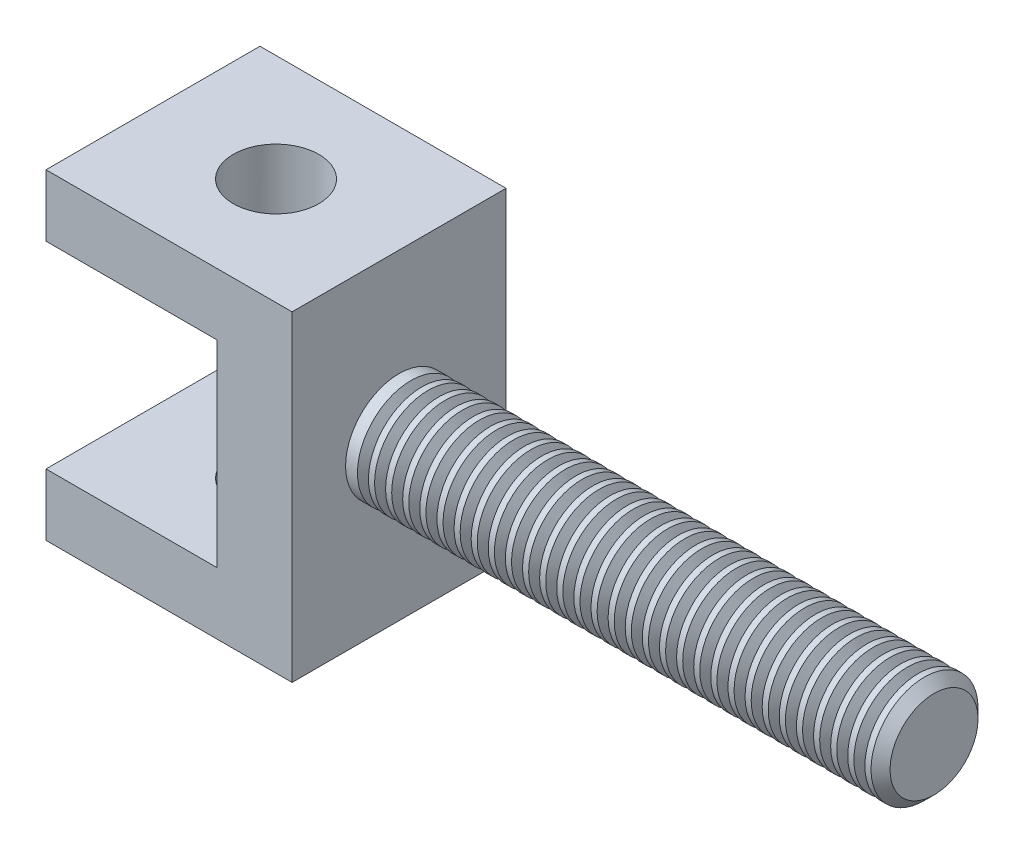
from build123d import *

# Parameters (mm, degrees)
BASEHEAD_DEPTH      = 3.5
THDSCHPAT_COUNT     = 30
THDSCHPAT_PITCH     = 0.8
BOSS_EXTRUDE1_DEPTH = 5
SKETCH3_R           = 2
CUT_EXTRUDE1_DEPTH  = 17


with BuildPart() as part:
    # BaseHeadSke → BaseHead (new body)
    with BuildSketch(Plane(origin=(0, 0, 0), x_dir=(0, 0, -1), z_dir=(1, 0, 0))):
        Polygon((0, 4.618802154), (-4, 2.309401077), (-4, -2.309401077), (0, -4.618802154), (4, -2.309401077), (4, 2.309401077), align=None)
    extrude(amount=BASEHEAD_DEPTH)

    # HeadChamferSke → HeadChamfer (revolve, cut)
    with BuildSketch(Plane.XY):
        Polygon((0, 4.618802154), (0, 4), (0.35726559, 4.618802154), align=None)
    revolve(axis=Axis((0, 0, 0), (1, 0, 0)), mode=Mode.SUBTRACT)

    # BodySke → BaseBody (revolve)
    with BuildSketch(Plane.XY, mode=Mode.PRIVATE) as basebody_sk:
        Polygon((0, 0), (0, 2.5), (28.055, 2.5), (28.5, 2.055), (28.5, 0), align=None)
    revolve(basebody_sk.sketch.rotate(Axis((0, 0, 0), (1, 0, 0)), 90), axis=Axis((0, 0, 0), (1, 0, 0)))

    # ThdSchSke → ThreadSchematic (revolve, cut)
    with BuildSketch(Plane.XY, mode=Mode.PRIVATE) as threadschematic_sk:
        Polygon((27.255, 3.01384174), (27.255, 2.5), (27.51192087, 2.055), (27.76884174, 2.5), (27.76884174, 3.01384174), align=None)
    threadschematic = revolve(threadschematic_sk.sketch.rotate(Axis((0, 0, 0), (1, 0, 0)), 90), axis=Axis((0, 0, 0), (1, 0, 0)), mode=Mode.SUBTRACT)

    # ThdSchPat: ThreadSchematic ×30
    with Locations(*[(-i * THDSCHPAT_PITCH, 0, 0) for i in range(1, THDSCHPAT_COUNT)]):
        add(threadschematic, mode=Mode.SUBTRACT)

    # Sketch1 → Boss-Extrude1 (add, symmetric)
    with BuildSketch(Plane.XY):
        Polygon((-8, 7.5), (3.5, 7.5), (3.5, -7.5), (-8, -7.5), (-8, -4.608070982), (0, -4.608070982), (0, 4.608070982), (-8, 4.608070982), align=None)
    extrude(amount=BOSS_EXTRUDE1_DEPTH, both=True)

    # Sketch3 → Cut-Extrude1 (cut)
    with BuildSketch(Plane.XZ.offset(7.5)):
        with Locations(Location((-2.25, 0, 0), (0, 0, 270))):
            Circle(SKETCH3_R)
    extrude(amount=-CUT_EXTRUDE1_DEPTH, mode=Mode.SUBTRACT)


solid = part.part
